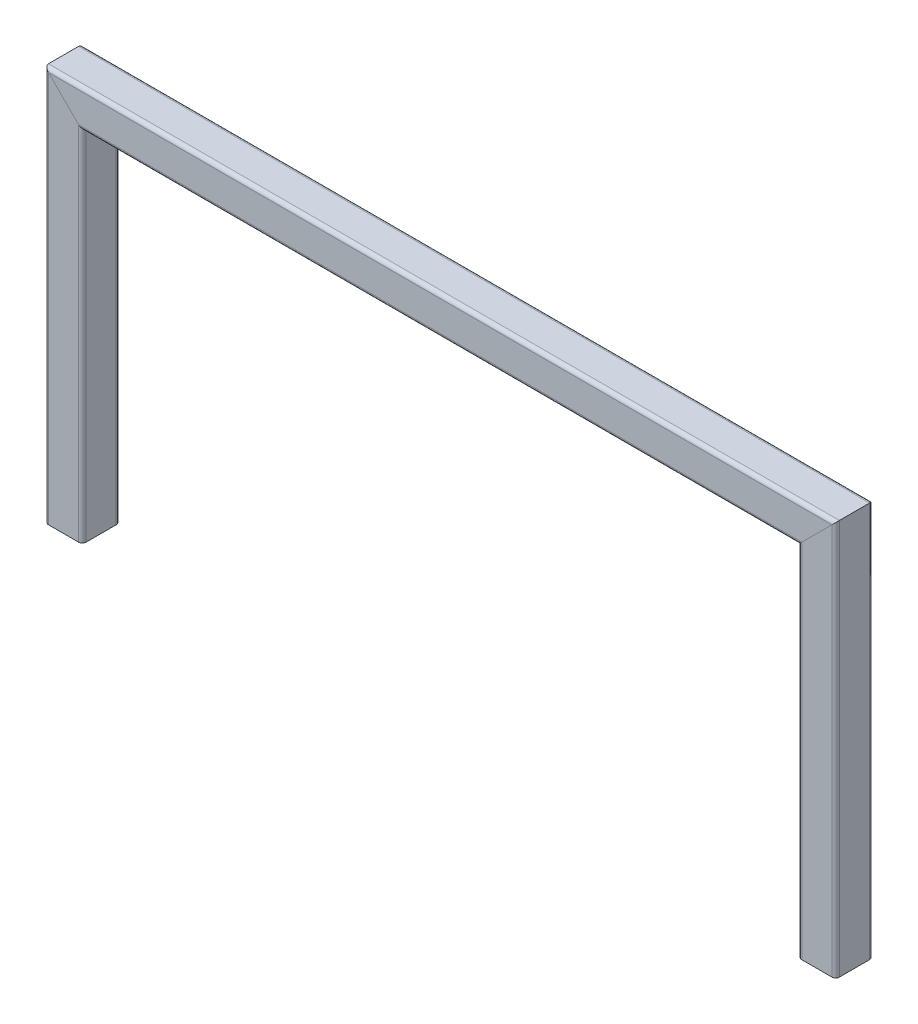
from build123d import *


with BuildPart() as part:
    # Balayage1: sweep along a path in Esquisse1
    with BuildLine(Plane.XY) as balayage1_path:
        Line((0, 0), (0, 300))
        Line((0, 300), (600, 300))
        Line((600, 300), (600, 0))
    # Esquisse2 → Balayage1 (sweep)
    with BuildSketch(Plane(origin=(0, 0, 0), x_dir=(1, 0, 0), z_dir=(0, 1, 0))):
        with BuildLine():
            Line((-12, -15), (12, -15))
            ThreePointArc((12, -15), (14.121320344, -14.121320344), (15, -12))
            Line((15, -12), (15, 12))
            ThreePointArc((15, 12), (14.121320344, 14.121320344), (12, 15))
            Line((12, 15), (-12, 15))
            ThreePointArc((-12, 15), (-14.121320344, 14.121320344), (-15, 12))
            Line((-15, 12), (-15, -12))
            ThreePointArc((-15, -12), (-14.121320344, -14.121320344), (-12, -15))
        make_face()
        with BuildLine():
            Line((-10, -13), (10, -13))
            ThreePointArc((10, -13), (12.121320344, -12.121320344), (13, -10))
            Line((13, -10), (13, 10))
            ThreePointArc((13, 10), (12.121320344, 12.121320344), (10, 13))
            Line((10, 13), (-10, 13))
            ThreePointArc((-10, 13), (-12.121320344, 12.121320344), (-13, 10))
            Line((-13, 10), (-13, -10))
            ThreePointArc((-13, -10), (-12.121320344, -12.121320344), (-10, -13))
        make_face(mode=Mode.SUBTRACT)
    sweep(path=balayage1_path.line, transition=Transition.RIGHT)


solid = part.part
